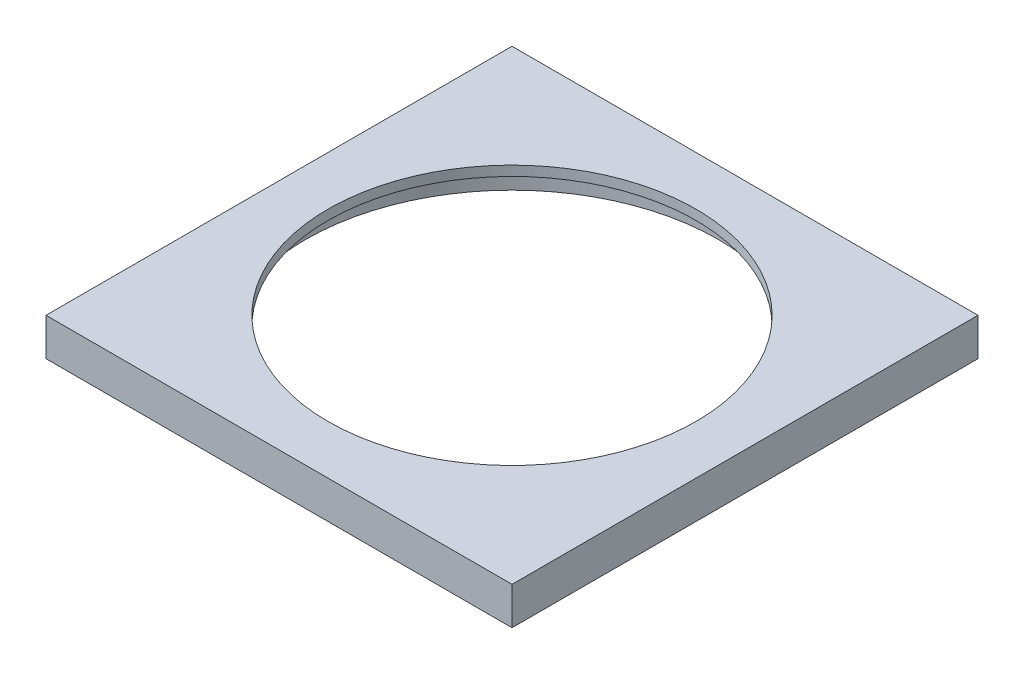
from build123d import *

# Parameters (mm, degrees)
SKIZZE1_W                       = 57
SKIZZE1_H                       = 57
SKIZZE1_R                       = 25.25
AUFSATZ_LINEAR_AUSTRAGEN1_DEPTH = 3.4
AUFSATZ_LINEAR_START            = 3.4
SKIZZE1_3_W                     = 57
SKIZZE1_3_H                     = 57
SKIZZE1_3_R                     = 25.25
SKIZZE1_3_R_2                   = 22.5
AUFSATZ_LINEAR_AUSTRAGEN2_DEPTH = 1.2


with BuildPart() as part:
    # Skizze1 → Aufsatz-Linear austragen1 (new body)
    with BuildSketch(Plane(origin=(0, 0, 0), x_dir=(1, 0, 0), z_dir=(0, 1, 0))):
        Rectangle(SKIZZE1_W, SKIZZE1_H)
        with Locations(Location((0, 0, 0), (0, 0, 270))):
            Circle(SKIZZE1_R, mode=Mode.SUBTRACT)
    extrude(amount=AUFSATZ_LINEAR_AUSTRAGEN1_DEPTH)

    # Skizze1<3> → Aufsatz-Linear austragen2 (add)
    # profile 1 of 2: a face of its own
    with BuildSketch(Plane(origin=(0, 0, 0), x_dir=(1, 0, 0), z_dir=(0, 1, 0)).offset(AUFSATZ_LINEAR_START)):
        Rectangle(SKIZZE1_3_W, SKIZZE1_3_H)
        with Locations(Location((0, 0, 0), (0, 0, 270))):
            Circle(SKIZZE1_3_R, mode=Mode.SUBTRACT)
    # profile 2 of 2: a face of its own
    with BuildSketch(Plane(origin=(0, 0, 0), x_dir=(1, 0, 0), z_dir=(0, 1, 0)).offset(AUFSATZ_LINEAR_START)):
        with Locations(Location((0, 0, 0), (0, 0, 270))):
            Circle(SKIZZE1_3_R)
        with Locations(Location((0, 0, 0), (0, 0, 270))):
            Circle(SKIZZE1_3_R_2, mode=Mode.SUBTRACT)
    extrude(amount=AUFSATZ_LINEAR_AUSTRAGEN2_DEPTH)


solid = part.part
